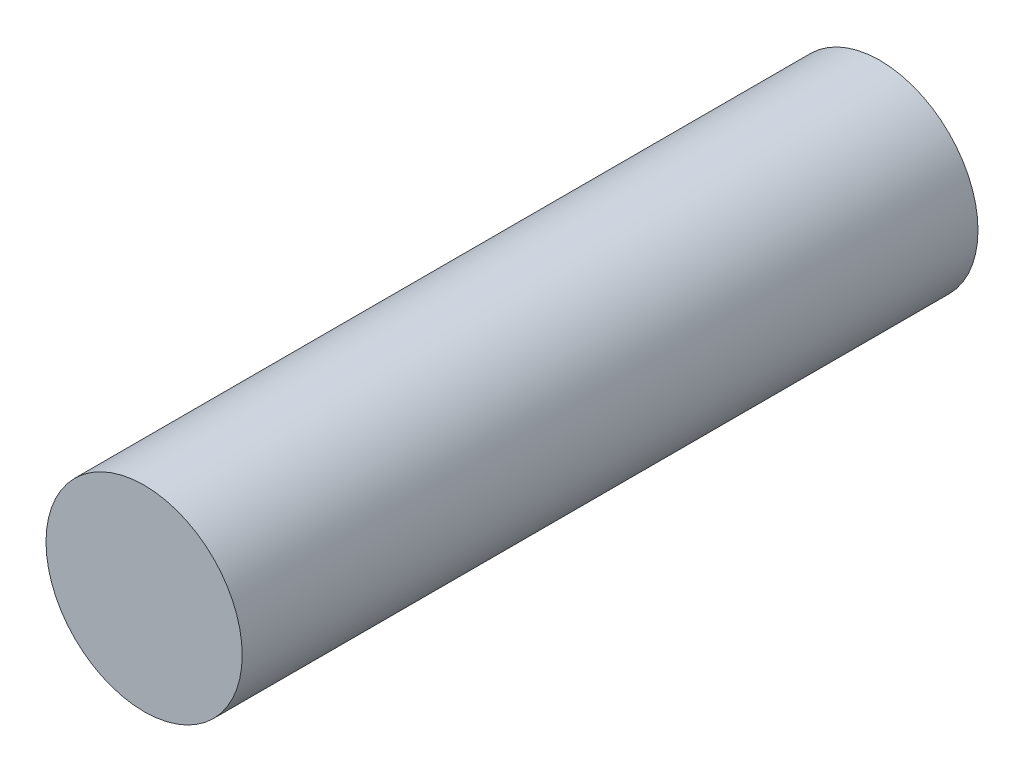
from build123d import *

# Parameters (mm, degrees)
SKETCH_1_R      = 10.16
EXTRUDE_1_DEPTH = 76.2


with BuildPart() as part:
    # 草图1 → 凸台-拉伸1 (new body)
    with BuildSketch(Plane.XY):
        with Locations(Location((0, 0, 0), (0, 0, 180))):
            Circle(SKETCH_1_R)
    extrude(amount=EXTRUDE_1_DEPTH)


solid = part.part
